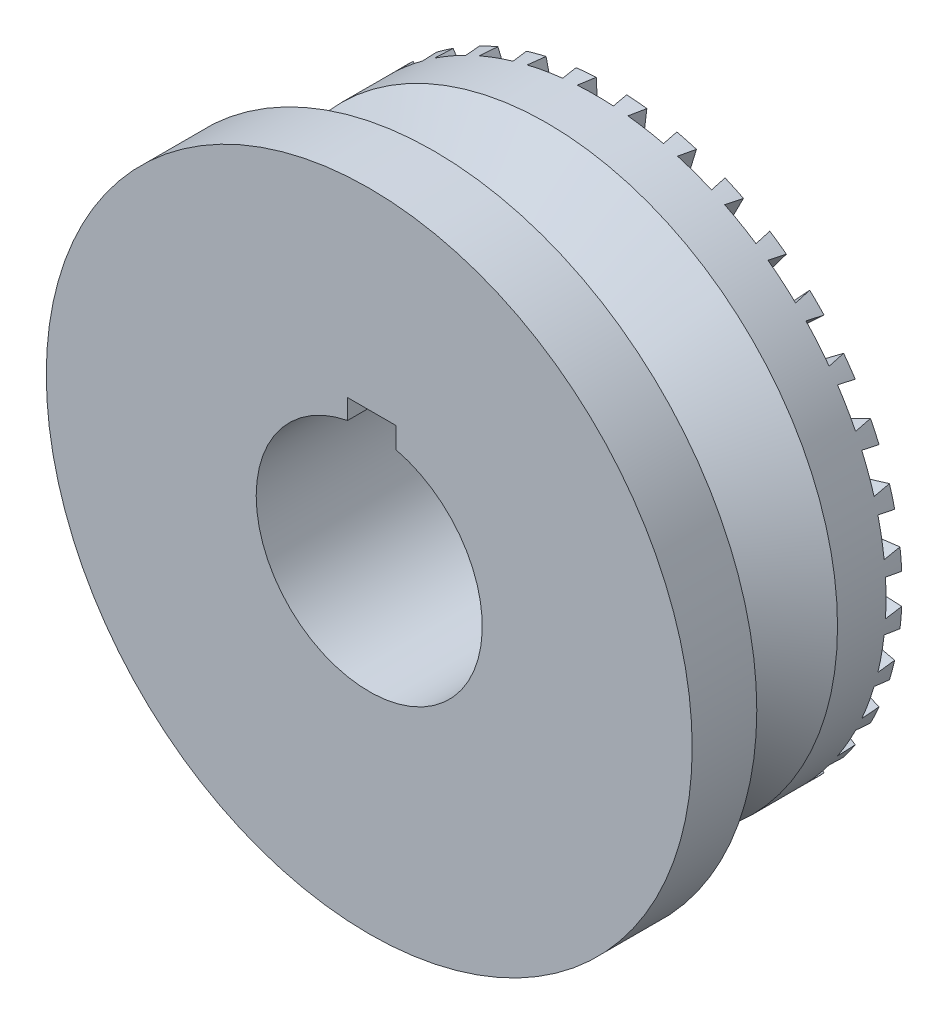
from build123d import *

# Parameters (mm, degrees)
SKETCH_2_R                       = 10
SKETCH_2_R_2                     = 7
CUT_EXTRUDE_1_DEPTH              = 4
CUT_EXTRUDE_2_REACH              = 34.016
SKETCH_2_3_R                     = 7
CUT_EXTRUDE_6_DEPTH              = 1
CUT_EXTRUDE_6_DRAFT              = 10
PATTERN_CIRCULAR_1_COPY_1_DEPTH  = 1
PATTERN_CIRCULAR_1_COPY_1_DRAFT  = 10
PATTERN_CIRCULAR_1_COPY_2_DEPTH  = 1
PATTERN_CIRCULAR_1_COPY_2_DRAFT  = 10
PATTERN_CIRCULAR_1_COPY_3_DEPTH  = 1
PATTERN_CIRCULAR_1_COPY_3_DRAFT  = 10
PATTERN_CIRCULAR_1_COPY_4_DEPTH  = 1
PATTERN_CIRCULAR_1_COPY_4_DRAFT  = 10
PATTERN_CIRCULAR_1_COPY_5_DEPTH  = 1
PATTERN_CIRCULAR_1_COPY_5_DRAFT  = 10
PATTERN_CIRCULAR_1_COPY_6_DEPTH  = 1
PATTERN_CIRCULAR_1_COPY_6_DRAFT  = 10
PATTERN_CIRCULAR_1_COPY_7_DEPTH  = 1
PATTERN_CIRCULAR_1_COPY_7_DRAFT  = 10
PATTERN_CIRCULAR_1_COPY_8_DEPTH  = 1
PATTERN_CIRCULAR_1_COPY_8_DRAFT  = 10
PATTERN_CIRCULAR_1_COPY_9_DEPTH  = 1
PATTERN_CIRCULAR_1_COPY_9_DRAFT  = 10
PATTERN_CIRCULAR_1_COPY_10_DEPTH = 1
PATTERN_CIRCULAR_1_COPY_10_DRAFT = 10
PATTERN_CIRCULAR_1_COPY_11_DEPTH = 1
PATTERN_CIRCULAR_1_COPY_11_DRAFT = 10
PATTERN_CIRCULAR_1_COPY_12_DEPTH = 1
PATTERN_CIRCULAR_1_COPY_12_DRAFT = 10
PATTERN_CIRCULAR_1_COPY_13_DEPTH = 1
PATTERN_CIRCULAR_1_COPY_13_DRAFT = 10
PATTERN_CIRCULAR_1_COPY_14_DEPTH = 1
PATTERN_CIRCULAR_1_COPY_14_DRAFT = 10
PATTERN_CIRCULAR_1_COPY_15_DEPTH = 1
PATTERN_CIRCULAR_1_COPY_15_DRAFT = 10
PATTERN_CIRCULAR_1_COPY_16_DEPTH = 1
PATTERN_CIRCULAR_1_COPY_16_DRAFT = 10
PATTERN_CIRCULAR_1_COPY_17_DEPTH = 1
PATTERN_CIRCULAR_1_COPY_17_DRAFT = 10
PATTERN_CIRCULAR_1_COPY_18_DEPTH = 1
PATTERN_CIRCULAR_1_COPY_18_DRAFT = 10
PATTERN_CIRCULAR_1_COPY_19_DEPTH = 1
PATTERN_CIRCULAR_1_COPY_19_DRAFT = 10
PATTERN_CIRCULAR_1_COPY_20_DEPTH = 1
PATTERN_CIRCULAR_1_COPY_20_DRAFT = 10
PATTERN_CIRCULAR_1_COPY_21_DEPTH = 1
PATTERN_CIRCULAR_1_COPY_21_DRAFT = 10
PATTERN_CIRCULAR_1_COPY_22_DEPTH = 1
PATTERN_CIRCULAR_1_COPY_22_DRAFT = 10
PATTERN_CIRCULAR_1_COPY_23_DEPTH = 1
PATTERN_CIRCULAR_1_COPY_23_DRAFT = 10
PATTERN_CIRCULAR_1_COPY_24_DEPTH = 1
PATTERN_CIRCULAR_1_COPY_24_DRAFT = 10
PATTERN_CIRCULAR_1_COPY_25_DEPTH = 1
PATTERN_CIRCULAR_1_COPY_25_DRAFT = 10
PATTERN_CIRCULAR_1_COPY_26_DEPTH = 1
PATTERN_CIRCULAR_1_COPY_26_DRAFT = 10
PATTERN_CIRCULAR_1_COPY_27_DEPTH = 1
PATTERN_CIRCULAR_1_COPY_27_DRAFT = 10
PATTERN_CIRCULAR_1_COPY_28_DEPTH = 1
PATTERN_CIRCULAR_1_COPY_28_DRAFT = 10
PATTERN_CIRCULAR_1_COPY_29_DEPTH = 1
PATTERN_CIRCULAR_1_COPY_29_DRAFT = 10
PATTERN_CIRCULAR_1_COPY_30_DEPTH = 1
PATTERN_CIRCULAR_1_COPY_30_DRAFT = 10
PATTERN_CIRCULAR_1_COPY_31_DEPTH = 1
PATTERN_CIRCULAR_1_COPY_31_DRAFT = 10
PATTERN_CIRCULAR_1_COPY_32_DEPTH = 1
PATTERN_CIRCULAR_1_COPY_32_DRAFT = 10
PATTERN_CIRCULAR_1_COPY_33_DEPTH = 1
PATTERN_CIRCULAR_1_COPY_33_DRAFT = 10
PATTERN_CIRCULAR_1_COPY_34_DEPTH = 1
PATTERN_CIRCULAR_1_COPY_34_DRAFT = 10
PATTERN_CIRCULAR_1_COPY_35_DEPTH = 1
PATTERN_CIRCULAR_1_COPY_35_DRAFT = 10
CUT_EXTRUDE_7_DEPTH              = 31.347981811


with BuildPart() as part:
    # 草图1 → 旋转1 (revolve)
    with BuildSketch(Plane(origin=(0, 0, 0), x_dir=(0, 0, -1), z_dir=(1, 0, 0))):
        Polygon((-7, 20), (-7, 0), (8, 0), (8, 18), (4, 18), (0, 13), (-3, 13), (-3, 20), align=None)
    revolve(axis=Axis((0, 0, 7), (0, 0, -1)))

    # 草图2 → 切除-拉伸1 (cut)
    with BuildSketch(Plane(origin=(0, 0, -8), x_dir=(-1, 0, 0), z_dir=(0, 0, -1))):
        Circle(SKETCH_2_R)
        Circle(SKETCH_2_R_2, mode=Mode.SUBTRACT)
    extrude(amount=-CUT_EXTRUDE_1_DEPTH, mode=Mode.SUBTRACT)

    # 草图2<3> → 切除-拉伸2 (cut, up to next)
    with BuildSketch(Plane(origin=(0, 0, -8), x_dir=(-1, 0, 0), z_dir=(0, 0, -1)), mode=Mode.PRIVATE) as cut_extrude_2_sk1:
        Circle(SKETCH_2_3_R)
    cut_extrude_2_tool1 = extrude(cut_extrude_2_sk1.sketch, amount=-CUT_EXTRUDE_2_REACH, mode=Mode.PRIVATE) & part.part
    add(cut_extrude_2_tool1.solids().sort_by_distance((0, 0, -8))[0], mode=Mode.SUBTRACT)


with BuildPart() as cut_extrude_6_tool:
    # 草图3 → 切除-拉伸6 (with draft: the straight prism first)
    with BuildSketch(Plane(origin=(0, 0, -8), x_dir=(-1, 0, 0), z_dir=(0, 0, -1))):
        with BuildLine():
            Line((-0.942047212, 17.975331626), (0, 0))
            Line((0, 0), (0.942047212, 17.975331626))
            ThreePointArc((0.942047212, 17.975331626), (0, 18), (-0.942047212, 17.975331626))
        make_face()
    extrude(amount=-CUT_EXTRUDE_6_DEPTH)
    # 切除-拉伸6: the draft: its side faces are tilted about the plane it starts from
    cut_extrude_6_sides = [cut_extrude_6_tool.faces().sort_by_distance(p)[0] for p in [
        (0.471023606, 8.987665813, -7.5),
        (-0.471023606, 8.987665813, -7.5),
        (0, 18, -7.5),
    ]]
    draft(cut_extrude_6_sides, Plane(origin=(0, 0, -8), x_dir=(-1, 0, 0), z_dir=(0, 0, -1)), CUT_EXTRUDE_6_DRAFT)


with BuildPart() as part_1:
    add(part.part)

    # 切除-拉伸6: cut by cut_extrude_6_tool
    add(cut_extrude_6_tool.part, mode=Mode.SUBTRACT)


with BuildPart() as pattern_circular_1_copy_1_tool:
    # 阵列(圆周)1 copy 1 sketch → 阵列(圆周)1 copy 1 (with draft: the straight prism first)
    with BuildSketch(Plane(origin=(0, 0, -8), x_dir=(-0.984807753012208, -0.17364817766693033, 0), z_dir=(0, 0, -1))):
        with BuildLine():
            Line((-0.942047212, 17.975331626), (0, 0))
            Line((0, 0), (0.942047212, 17.975331626))
            ThreePointArc((0.942047212, 17.975331626), (0, 18), (-0.942047212, 17.975331626))
        make_face()
    extrude(amount=-PATTERN_CIRCULAR_1_COPY_1_DEPTH)
    # 阵列(圆周)1 copy 1: the draft: its side faces are tilted about the plane it starts from
    pattern_circular_1_copy_1_sides = [pattern_circular_1_copy_1_tool.faces().sort_by_distance(p)[0] for p in [
        (-1.096824091, 8.932915365, -7.5),
        (-2.024559489, 8.769330583, -7.5),
        (-3.125667198, 17.726539554, -7.5),
    ]]
    draft(pattern_circular_1_copy_1_sides, Plane(origin=(0, 0, -8), x_dir=(-0.984807753012208, -0.17364817766693033, 0), z_dir=(0, 0, -1)), PATTERN_CIRCULAR_1_COPY_1_DRAFT)


with BuildPart() as part_2:
    add(part_1.part)

    # 阵列(圆周)1 copy 1: cut by pattern_circular_1_copy_1_tool
    add(pattern_circular_1_copy_1_tool.part, mode=Mode.SUBTRACT)


with BuildPart() as pattern_circular_1_copy_2_tool:
    # 阵列(圆周)1 copy 2 sketch → 阵列(圆周)1 copy 2 (with draft: the straight prism first)
    with BuildSketch(Plane(origin=(0, 0, -8), x_dir=(-0.9396926207859084, -0.3420201433256687, 0), z_dir=(0, 0, -1))):
        with BuildLine():
            Line((-0.942047212, 17.975331626), (0, 0))
            Line((0, 0), (0.942047212, 17.975331626))
            ThreePointArc((0.942047212, 17.975331626), (0, 18), (-0.942047212, 17.975331626))
        make_face()
    extrude(amount=-PATTERN_CIRCULAR_1_COPY_2_DEPTH)
    # 阵列(圆周)1 copy 2: the draft: its side faces are tilted about the plane it starts from
    pattern_circular_1_copy_2_sides = [pattern_circular_1_copy_2_tool.faces().sort_by_distance(p)[0] for p in [
        (-2.631345343, 8.606742804, -7.5),
        (-3.516580156, 8.284543681, -7.5),
        (-6.15636258, 16.914467174, -7.5),
    ]]
    draft(pattern_circular_1_copy_2_sides, Plane(origin=(0, 0, -8), x_dir=(-0.9396926207859084, -0.3420201433256687, 0), z_dir=(0, 0, -1)), PATTERN_CIRCULAR_1_COPY_2_DRAFT)


with BuildPart() as part_3:
    add(part_2.part)

    # 阵列(圆周)1 copy 2: cut by pattern_circular_1_copy_2_tool
    add(pattern_circular_1_copy_2_tool.part, mode=Mode.SUBTRACT)


with BuildPart() as pattern_circular_1_copy_3_tool:
    # 阵列(圆周)1 copy 3 sketch → 阵列(圆周)1 copy 3 (with draft: the straight prism first)
    with BuildSketch(Plane(origin=(0, 0, -8), x_dir=(-0.8660254037844387, -0.49999999999999994, 0), z_dir=(0, 0, -1))):
        with BuildLine():
            Line((-0.942047212, 17.975331626), (0, 0))
            Line((0, 0), (0.942047212, 17.975331626))
            ThreePointArc((0.942047212, 17.975331626), (0, 18), (-0.942047212, 17.975331626))
        make_face()
    extrude(amount=-PATTERN_CIRCULAR_1_COPY_3_DEPTH)
    # 阵列(圆周)1 copy 3: the draft: its side faces are tilted about the plane it starts from
    pattern_circular_1_copy_3_sides = [pattern_circular_1_copy_3_tool.faces().sort_by_distance(p)[0] for p in [
        (-4.085914498, 8.019058718, -7.5),
        (-4.901751315, 7.548035112, -7.5),
        (-9, 15.588457268, -7.5),
    ]]
    draft(pattern_circular_1_copy_3_sides, Plane(origin=(0, 0, -8), x_dir=(-0.8660254037844387, -0.49999999999999994, 0), z_dir=(0, 0, -1)), PATTERN_CIRCULAR_1_COPY_3_DRAFT)


with BuildPart() as part_4:
    add(part_3.part)

    # 阵列(圆周)1 copy 3: cut by pattern_circular_1_copy_3_tool
    add(pattern_circular_1_copy_3_tool.part, mode=Mode.SUBTRACT)


with BuildPart() as pattern_circular_1_copy_4_tool:
    # 阵列(圆周)1 copy 4 sketch → 阵列(圆周)1 copy 4 (with draft: the straight prism first)
    with BuildSketch(Plane(origin=(0, 0, -8), x_dir=(-0.766044443118978, -0.6427876096865393, 0), z_dir=(0, 0, -1))):
        with BuildLine():
            Line((-0.942047212, 17.975331626), (0, 0))
            Line((0, 0), (0.942047212, 17.975331626))
            ThreePointArc((0.942047212, 17.975331626), (0, 18), (-0.942047212, 17.975331626))
        make_face()
    extrude(amount=-PATTERN_CIRCULAR_1_COPY_4_DEPTH)
    # 阵列(圆周)1 copy 4: the draft: its side faces are tilted about the plane it starts from
    pattern_circular_1_copy_4_sides = [pattern_circular_1_copy_4_tool.faces().sort_by_distance(p)[0] for p in [
        (-5.416335209, 7.18771959, -7.5),
        (-6.137985241, 6.582183315, -7.5),
        (-11.570176974, 13.788799976, -7.5),
    ]]
    draft(pattern_circular_1_copy_4_sides, Plane(origin=(0, 0, -8), x_dir=(-0.766044443118978, -0.6427876096865393, 0), z_dir=(0, 0, -1)), PATTERN_CIRCULAR_1_COPY_4_DRAFT)


with BuildPart() as part_5:
    add(part_4.part)

    # 阵列(圆周)1 copy 4: cut by pattern_circular_1_copy_4_tool
    add(pattern_circular_1_copy_4_tool.part, mode=Mode.SUBTRACT)


with BuildPart() as pattern_circular_1_copy_5_tool:
    # 阵列(圆周)1 copy 5 sketch → 阵列(圆周)1 copy 5 (with draft: the straight prism first)
    with BuildSketch(Plane(origin=(0, 0, -8), x_dir=(-0.6427876096865394, -0.766044443118978, 0), z_dir=(0, 0, -1))):
        with BuildLine():
            Line((-0.942047212, 17.975331626), (0, 0))
            Line((0, 0), (0.942047212, 17.975331626))
            ThreePointArc((0.942047212, 17.975331626), (0, 18), (-0.942047212, 17.975331626))
        make_face()
    extrude(amount=-PATTERN_CIRCULAR_1_COPY_5_DEPTH)
    # 阵列(圆周)1 copy 5: the draft: its side faces are tilted about the plane it starts from
    pattern_circular_1_copy_5_sides = [pattern_circular_1_copy_5_tool.faces().sort_by_distance(p)[0] for p in [
        (-6.582183315, 6.137985241, -7.5),
        (-7.18771959, 5.416335209, -7.5),
        (-13.788799976, 11.570176974, -7.5),
    ]]
    draft(pattern_circular_1_copy_5_sides, Plane(origin=(0, 0, -8), x_dir=(-0.6427876096865394, -0.766044443118978, 0), z_dir=(0, 0, -1)), PATTERN_CIRCULAR_1_COPY_5_DRAFT)


with BuildPart() as part_6:
    add(part_5.part)

    # 阵列(圆周)1 copy 5: cut by pattern_circular_1_copy_5_tool
    add(pattern_circular_1_copy_5_tool.part, mode=Mode.SUBTRACT)


with BuildPart() as pattern_circular_1_copy_6_tool:
    # 阵列(圆周)1 copy 6 sketch → 阵列(圆周)1 copy 6 (with draft: the straight prism first)
    with BuildSketch(Plane(origin=(0, 0, -8), x_dir=(-0.5000000000000001, -0.8660254037844386, 0), z_dir=(0, 0, -1))):
        with BuildLine():
            Line((-0.942047212, 17.975331626), (0, 0))
            Line((0, 0), (0.942047212, 17.975331626))
            ThreePointArc((0.942047212, 17.975331626), (0, 18), (-0.942047212, 17.975331626))
        make_face()
    extrude(amount=-PATTERN_CIRCULAR_1_COPY_6_DEPTH)
    # 阵列(圆周)1 copy 6: the draft: its side faces are tilted about the plane it starts from
    pattern_circular_1_copy_6_sides = [pattern_circular_1_copy_6_tool.faces().sort_by_distance(p)[0] for p in [
        (-7.548035112, 4.901751315, -7.5),
        (-8.019058718, 4.085914498, -7.5),
        (-15.588457268, 9, -7.5),
    ]]
    draft(pattern_circular_1_copy_6_sides, Plane(origin=(0, 0, -8), x_dir=(-0.5000000000000001, -0.8660254037844386, 0), z_dir=(0, 0, -1)), PATTERN_CIRCULAR_1_COPY_6_DRAFT)


with BuildPart() as part_7:
    add(part_6.part)

    # 阵列(圆周)1 copy 6: cut by pattern_circular_1_copy_6_tool
    add(pattern_circular_1_copy_6_tool.part, mode=Mode.SUBTRACT)


with BuildPart() as pattern_circular_1_copy_7_tool:
    # 阵列(圆周)1 copy 7 sketch → 阵列(圆周)1 copy 7 (with draft: the straight prism first)
    with BuildSketch(Plane(origin=(0, 0, -8), x_dir=(-0.3420201433256688, -0.9396926207859083, 0), z_dir=(0, 0, -1))):
        with BuildLine():
            Line((-0.942047212, 17.975331626), (0, 0))
            Line((0, 0), (0.942047212, 17.975331626))
            ThreePointArc((0.942047212, 17.975331626), (0, 18), (-0.942047212, 17.975331626))
        make_face()
    extrude(amount=-PATTERN_CIRCULAR_1_COPY_7_DEPTH)
    # 阵列(圆周)1 copy 7: the draft: its side faces are tilted about the plane it starts from
    pattern_circular_1_copy_7_sides = [pattern_circular_1_copy_7_tool.faces().sort_by_distance(p)[0] for p in [
        (-8.284543681, 3.516580156, -7.5),
        (-8.606742804, 2.631345343, -7.5),
        (-16.914467174, 6.15636258, -7.5),
    ]]
    draft(pattern_circular_1_copy_7_sides, Plane(origin=(0, 0, -8), x_dir=(-0.3420201433256688, -0.9396926207859083, 0), z_dir=(0, 0, -1)), PATTERN_CIRCULAR_1_COPY_7_DRAFT)


with BuildPart() as part_8:
    add(part_7.part)

    # 阵列(圆周)1 copy 7: cut by pattern_circular_1_copy_7_tool
    add(pattern_circular_1_copy_7_tool.part, mode=Mode.SUBTRACT)


with BuildPart() as pattern_circular_1_copy_8_tool:
    # 阵列(圆周)1 copy 8 sketch → 阵列(圆周)1 copy 8 (with draft: the straight prism first)
    with BuildSketch(Plane(origin=(0, 0, -8), x_dir=(-0.17364817766693041, -0.984807753012208, 0), z_dir=(0, 0, -1))):
        with BuildLine():
            Line((-0.942047212, 17.975331626), (0, 0))
            Line((0, 0), (0.942047212, 17.975331626))
            ThreePointArc((0.942047212, 17.975331626), (0, 18), (-0.942047212, 17.975331626))
        make_face()
    extrude(amount=-PATTERN_CIRCULAR_1_COPY_8_DEPTH)
    # 阵列(圆周)1 copy 8: the draft: its side faces are tilted about the plane it starts from
    pattern_circular_1_copy_8_sides = [pattern_circular_1_copy_8_tool.faces().sort_by_distance(p)[0] for p in [
        (-8.769330583, 2.024559489, -7.5),
        (-8.932915365, 1.096824091, -7.5),
        (-17.726539554, 3.125667198, -7.5),
    ]]
    draft(pattern_circular_1_copy_8_sides, Plane(origin=(0, 0, -8), x_dir=(-0.17364817766693041, -0.984807753012208, 0), z_dir=(0, 0, -1)), PATTERN_CIRCULAR_1_COPY_8_DRAFT)


with BuildPart() as part_9:
    add(part_8.part)

    # 阵列(圆周)1 copy 8: cut by pattern_circular_1_copy_8_tool
    add(pattern_circular_1_copy_8_tool.part, mode=Mode.SUBTRACT)


with BuildPart() as pattern_circular_1_copy_9_tool:
    # 阵列(圆周)1 copy 9 sketch → 阵列(圆周)1 copy 9 (with draft: the straight prism first)
    with BuildSketch(Plane(origin=(0, 0, -8), x_dir=(0, -1, 0), z_dir=(0, 0, -1))):
        with BuildLine():
            Line((-0.942047212, 17.975331626), (0, 0))
            Line((0, 0), (0.942047212, 17.975331626))
            ThreePointArc((0.942047212, 17.975331626), (0, 18), (-0.942047212, 17.975331626))
        make_face()
    extrude(amount=-PATTERN_CIRCULAR_1_COPY_9_DEPTH)
    # 阵列(圆周)1 copy 9: the draft: its side faces are tilted about the plane it starts from
    pattern_circular_1_copy_9_sides = [pattern_circular_1_copy_9_tool.faces().sort_by_distance(p)[0] for p in [
        (-8.987665813, 0.471023606, -7.5),
        (-8.987665813, -0.471023606, -7.5),
        (-18, 0, -7.5),
    ]]
    draft(pattern_circular_1_copy_9_sides, Plane(origin=(0, 0, -8), x_dir=(0, -1, 0), z_dir=(0, 0, -1)), PATTERN_CIRCULAR_1_COPY_9_DRAFT)


with BuildPart() as part_10:
    add(part_9.part)

    # 阵列(圆周)1 copy 9: cut by pattern_circular_1_copy_9_tool
    add(pattern_circular_1_copy_9_tool.part, mode=Mode.SUBTRACT)


with BuildPart() as pattern_circular_1_copy_10_tool:
    # 阵列(圆周)1 copy 10 sketch → 阵列(圆周)1 copy 10 (with draft: the straight prism first)
    with BuildSketch(Plane(origin=(0, 0, -8), x_dir=(0.1736481776669303, -0.984807753012208, 0), z_dir=(0, 0, -1))):
        with BuildLine():
            Line((-0.942047212, 17.975331626), (0, 0))
            Line((0, 0), (0.942047212, 17.975331626))
            ThreePointArc((0.942047212, 17.975331626), (0, 18), (-0.942047212, 17.975331626))
        make_face()
    extrude(amount=-PATTERN_CIRCULAR_1_COPY_10_DEPTH)
    # 阵列(圆周)1 copy 10: the draft: its side faces are tilted about the plane it starts from
    pattern_circular_1_copy_10_sides = [pattern_circular_1_copy_10_tool.faces().sort_by_distance(p)[0] for p in [
        (-8.932915365, -1.096824091, -7.5),
        (-8.769330583, -2.024559489, -7.5),
        (-17.726539554, -3.125667198, -7.5),
    ]]
    draft(pattern_circular_1_copy_10_sides, Plane(origin=(0, 0, -8), x_dir=(0.1736481776669303, -0.984807753012208, 0), z_dir=(0, 0, -1)), PATTERN_CIRCULAR_1_COPY_10_DRAFT)


with BuildPart() as part_11:
    add(part_10.part)

    # 阵列(圆周)1 copy 10: cut by pattern_circular_1_copy_10_tool
    add(pattern_circular_1_copy_10_tool.part, mode=Mode.SUBTRACT)


with BuildPart() as pattern_circular_1_copy_11_tool:
    # 阵列(圆周)1 copy 11 sketch → 阵列(圆周)1 copy 11 (with draft: the straight prism first)
    with BuildSketch(Plane(origin=(0, 0, -8), x_dir=(0.3420201433256687, -0.9396926207859084, 0), z_dir=(0, 0, -1))):
        with BuildLine():
            Line((-0.942047212, 17.975331626), (0, 0))
            Line((0, 0), (0.942047212, 17.975331626))
            ThreePointArc((0.942047212, 17.975331626), (0, 18), (-0.942047212, 17.975331626))
        make_face()
    extrude(amount=-PATTERN_CIRCULAR_1_COPY_11_DEPTH)
    # 阵列(圆周)1 copy 11: the draft: its side faces are tilted about the plane it starts from
    pattern_circular_1_copy_11_sides = [pattern_circular_1_copy_11_tool.faces().sort_by_distance(p)[0] for p in [
        (-8.606742804, -2.631345343, -7.5),
        (-8.284543681, -3.516580156, -7.5),
        (-16.914467174, -6.15636258, -7.5),
    ]]
    draft(pattern_circular_1_copy_11_sides, Plane(origin=(0, 0, -8), x_dir=(0.3420201433256687, -0.9396926207859084, 0), z_dir=(0, 0, -1)), PATTERN_CIRCULAR_1_COPY_11_DRAFT)


with BuildPart() as part_12:
    add(part_11.part)

    # 阵列(圆周)1 copy 11: cut by pattern_circular_1_copy_11_tool
    add(pattern_circular_1_copy_11_tool.part, mode=Mode.SUBTRACT)


with BuildPart() as pattern_circular_1_copy_12_tool:
    # 阵列(圆周)1 copy 12 sketch → 阵列(圆周)1 copy 12 (with draft: the straight prism first)
    with BuildSketch(Plane(origin=(0, 0, -8), x_dir=(0.4999999999999998, -0.8660254037844387, 0), z_dir=(0, 0, -1))):
        with BuildLine():
            Line((-0.942047212, 17.975331626), (0, 0))
            Line((0, 0), (0.942047212, 17.975331626))
            ThreePointArc((0.942047212, 17.975331626), (0, 18), (-0.942047212, 17.975331626))
        make_face()
    extrude(amount=-PATTERN_CIRCULAR_1_COPY_12_DEPTH)
    # 阵列(圆周)1 copy 12: the draft: its side faces are tilted about the plane it starts from
    pattern_circular_1_copy_12_sides = [pattern_circular_1_copy_12_tool.faces().sort_by_distance(p)[0] for p in [
        (-8.019058718, -4.085914498, -7.5),
        (-7.548035112, -4.901751315, -7.5),
        (-15.588457268, -9, -7.5),
    ]]
    draft(pattern_circular_1_copy_12_sides, Plane(origin=(0, 0, -8), x_dir=(0.4999999999999998, -0.8660254037844387, 0), z_dir=(0, 0, -1)), PATTERN_CIRCULAR_1_COPY_12_DRAFT)


with BuildPart() as part_13:
    add(part_12.part)

    # 阵列(圆周)1 copy 12: cut by pattern_circular_1_copy_12_tool
    add(pattern_circular_1_copy_12_tool.part, mode=Mode.SUBTRACT)


with BuildPart() as pattern_circular_1_copy_13_tool:
    # 阵列(圆周)1 copy 13 sketch → 阵列(圆周)1 copy 13 (with draft: the straight prism first)
    with BuildSketch(Plane(origin=(0, 0, -8), x_dir=(0.6427876096865394, -0.766044443118978, 0), z_dir=(0, 0, -1))):
        with BuildLine():
            Line((-0.942047212, 17.975331626), (0, 0))
            Line((0, 0), (0.942047212, 17.975331626))
            ThreePointArc((0.942047212, 17.975331626), (0, 18), (-0.942047212, 17.975331626))
        make_face()
    extrude(amount=-PATTERN_CIRCULAR_1_COPY_13_DEPTH)
    # 阵列(圆周)1 copy 13: the draft: its side faces are tilted about the plane it starts from
    pattern_circular_1_copy_13_sides = [pattern_circular_1_copy_13_tool.faces().sort_by_distance(p)[0] for p in [
        (-7.18771959, -5.416335209, -7.5),
        (-6.582183315, -6.137985241, -7.5),
        (-13.788799976, -11.570176974, -7.5),
    ]]
    draft(pattern_circular_1_copy_13_sides, Plane(origin=(0, 0, -8), x_dir=(0.6427876096865394, -0.766044443118978, 0), z_dir=(0, 0, -1)), PATTERN_CIRCULAR_1_COPY_13_DRAFT)


with BuildPart() as part_14:
    add(part_13.part)

    # 阵列(圆周)1 copy 13: cut by pattern_circular_1_copy_13_tool
    add(pattern_circular_1_copy_13_tool.part, mode=Mode.SUBTRACT)


with BuildPart() as pattern_circular_1_copy_14_tool:
    # 阵列(圆周)1 copy 14 sketch → 阵列(圆周)1 copy 14 (with draft: the straight prism first)
    with BuildSketch(Plane(origin=(0, 0, -8), x_dir=(0.7660444431189779, -0.6427876096865395, 0), z_dir=(0, 0, -1))):
        with BuildLine():
            Line((-0.942047212, 17.975331626), (0, 0))
            Line((0, 0), (0.942047212, 17.975331626))
            ThreePointArc((0.942047212, 17.975331626), (0, 18), (-0.942047212, 17.975331626))
        make_face()
    extrude(amount=-PATTERN_CIRCULAR_1_COPY_14_DEPTH)
    # 阵列(圆周)1 copy 14: the draft: its side faces are tilted about the plane it starts from
    pattern_circular_1_copy_14_sides = [pattern_circular_1_copy_14_tool.faces().sort_by_distance(p)[0] for p in [
        (-6.137985241, -6.582183315, -7.5),
        (-5.416335209, -7.18771959, -7.5),
        (-11.570176974, -13.788799976, -7.5),
    ]]
    draft(pattern_circular_1_copy_14_sides, Plane(origin=(0, 0, -8), x_dir=(0.7660444431189779, -0.6427876096865395, 0), z_dir=(0, 0, -1)), PATTERN_CIRCULAR_1_COPY_14_DRAFT)


with BuildPart() as part_15:
    add(part_14.part)

    # 阵列(圆周)1 copy 14: cut by pattern_circular_1_copy_14_tool
    add(pattern_circular_1_copy_14_tool.part, mode=Mode.SUBTRACT)


with BuildPart() as pattern_circular_1_copy_15_tool:
    # 阵列(圆周)1 copy 15 sketch → 阵列(圆周)1 copy 15 (with draft: the straight prism first)
    with BuildSketch(Plane(origin=(0, 0, -8), x_dir=(0.8660254037844387, -0.49999999999999994, 0), z_dir=(0, 0, -1))):
        with BuildLine():
            Line((-0.942047212, 17.975331626), (0, 0))
            Line((0, 0), (0.942047212, 17.975331626))
            ThreePointArc((0.942047212, 17.975331626), (0, 18), (-0.942047212, 17.975331626))
        make_face()
    extrude(amount=-PATTERN_CIRCULAR_1_COPY_15_DEPTH)
    # 阵列(圆周)1 copy 15: the draft: its side faces are tilted about the plane it starts from
    pattern_circular_1_copy_15_sides = [pattern_circular_1_copy_15_tool.faces().sort_by_distance(p)[0] for p in [
        (-4.901751315, -7.548035112, -7.5),
        (-4.085914498, -8.019058718, -7.5),
        (-9, -15.588457268, -7.5),
    ]]
    draft(pattern_circular_1_copy_15_sides, Plane(origin=(0, 0, -8), x_dir=(0.8660254037844387, -0.49999999999999994, 0), z_dir=(0, 0, -1)), PATTERN_CIRCULAR_1_COPY_15_DRAFT)


with BuildPart() as part_16:
    add(part_15.part)

    # 阵列(圆周)1 copy 15: cut by pattern_circular_1_copy_15_tool
    add(pattern_circular_1_copy_15_tool.part, mode=Mode.SUBTRACT)


with BuildPart() as pattern_circular_1_copy_16_tool:
    # 阵列(圆周)1 copy 16 sketch → 阵列(圆周)1 copy 16 (with draft: the straight prism first)
    with BuildSketch(Plane(origin=(0, 0, -8), x_dir=(0.9396926207859083, -0.3420201433256689, 0), z_dir=(0, 0, -1))):
        with BuildLine():
            Line((-0.942047212, 17.975331626), (0, 0))
            Line((0, 0), (0.942047212, 17.975331626))
            ThreePointArc((0.942047212, 17.975331626), (0, 18), (-0.942047212, 17.975331626))
        make_face()
    extrude(amount=-PATTERN_CIRCULAR_1_COPY_16_DEPTH)
    # 阵列(圆周)1 copy 16: the draft: its side faces are tilted about the plane it starts from
    pattern_circular_1_copy_16_sides = [pattern_circular_1_copy_16_tool.faces().sort_by_distance(p)[0] for p in [
        (-3.516580156, -8.284543681, -7.5),
        (-2.631345343, -8.606742804, -7.5),
        (-6.15636258, -16.914467174, -7.5),
    ]]
    draft(pattern_circular_1_copy_16_sides, Plane(origin=(0, 0, -8), x_dir=(0.9396926207859083, -0.3420201433256689, 0), z_dir=(0, 0, -1)), PATTERN_CIRCULAR_1_COPY_16_DRAFT)


with BuildPart() as part_17:
    add(part_16.part)

    # 阵列(圆周)1 copy 16: cut by pattern_circular_1_copy_16_tool
    add(pattern_circular_1_copy_16_tool.part, mode=Mode.SUBTRACT)


with BuildPart() as pattern_circular_1_copy_17_tool:
    # 阵列(圆周)1 copy 17 sketch → 阵列(圆周)1 copy 17 (with draft: the straight prism first)
    with BuildSketch(Plane(origin=(0, 0, -8), x_dir=(0.984807753012208, -0.17364817766693028, 0), z_dir=(0, 0, -1))):
        with BuildLine():
            Line((-0.942047212, 17.975331626), (0, 0))
            Line((0, 0), (0.942047212, 17.975331626))
            ThreePointArc((0.942047212, 17.975331626), (0, 18), (-0.942047212, 17.975331626))
        make_face()
    extrude(amount=-PATTERN_CIRCULAR_1_COPY_17_DEPTH)
    # 阵列(圆周)1 copy 17: the draft: its side faces are tilted about the plane it starts from
    pattern_circular_1_copy_17_sides = [pattern_circular_1_copy_17_tool.faces().sort_by_distance(p)[0] for p in [
        (-2.024559489, -8.769330583, -7.5),
        (-1.096824091, -8.932915365, -7.5),
        (-3.125667198, -17.726539554, -7.5),
    ]]
    draft(pattern_circular_1_copy_17_sides, Plane(origin=(0, 0, -8), x_dir=(0.984807753012208, -0.17364817766693028, 0), z_dir=(0, 0, -1)), PATTERN_CIRCULAR_1_COPY_17_DRAFT)


with BuildPart() as part_18:
    add(part_17.part)

    # 阵列(圆周)1 copy 17: cut by pattern_circular_1_copy_17_tool
    add(pattern_circular_1_copy_17_tool.part, mode=Mode.SUBTRACT)


with BuildPart() as pattern_circular_1_copy_18_tool:
    # 阵列(圆周)1 copy 18 sketch → 阵列(圆周)1 copy 18 (with draft: the straight prism first)
    with BuildSketch(Plane(origin=(0, 0, -8), x_dir=(1, 0, 0), z_dir=(0, 0, -1))):
        with BuildLine():
            Line((-0.942047212, 17.975331626), (0, 0))
            Line((0, 0), (0.942047212, 17.975331626))
            ThreePointArc((0.942047212, 17.975331626), (0, 18), (-0.942047212, 17.975331626))
        make_face()
    extrude(amount=-PATTERN_CIRCULAR_1_COPY_18_DEPTH)
    # 阵列(圆周)1 copy 18: the draft: its side faces are tilted about the plane it starts from
    pattern_circular_1_copy_18_sides = [pattern_circular_1_copy_18_tool.faces().sort_by_distance(p)[0] for p in [
        (-0.471023606, -8.987665813, -7.5),
        (0.471023606, -8.987665813, -7.5),
        (0, -18, -7.5),
    ]]
    draft(pattern_circular_1_copy_18_sides, Plane(origin=(0, 0, -8), x_dir=(1, 0, 0), z_dir=(0, 0, -1)), PATTERN_CIRCULAR_1_COPY_18_DRAFT)


with BuildPart() as part_19:
    add(part_18.part)

    # 阵列(圆周)1 copy 18: cut by pattern_circular_1_copy_18_tool
    add(pattern_circular_1_copy_18_tool.part, mode=Mode.SUBTRACT)


with BuildPart() as pattern_circular_1_copy_19_tool:
    # 阵列(圆周)1 copy 19 sketch → 阵列(圆周)1 copy 19 (with draft: the straight prism first)
    with BuildSketch(Plane(origin=(0, 0, -8), x_dir=(0.984807753012208, 0.17364817766693047, 0), z_dir=(0, 0, -1))):
        with BuildLine():
            Line((-0.942047212, 17.975331626), (0, 0))
            Line((0, 0), (0.942047212, 17.975331626))
            ThreePointArc((0.942047212, 17.975331626), (0, 18), (-0.942047212, 17.975331626))
        make_face()
    extrude(amount=-PATTERN_CIRCULAR_1_COPY_19_DEPTH)
    # 阵列(圆周)1 copy 19: the draft: its side faces are tilted about the plane it starts from
    pattern_circular_1_copy_19_sides = [pattern_circular_1_copy_19_tool.faces().sort_by_distance(p)[0] for p in [
        (1.096824091, -8.932915365, -7.5),
        (2.024559489, -8.769330583, -7.5),
        (3.125667198, -17.726539554, -7.5),
    ]]
    draft(pattern_circular_1_copy_19_sides, Plane(origin=(0, 0, -8), x_dir=(0.984807753012208, 0.17364817766693047, 0), z_dir=(0, 0, -1)), PATTERN_CIRCULAR_1_COPY_19_DRAFT)


with BuildPart() as part_20:
    add(part_19.part)

    # 阵列(圆周)1 copy 19: cut by pattern_circular_1_copy_19_tool
    add(pattern_circular_1_copy_19_tool.part, mode=Mode.SUBTRACT)


with BuildPart() as pattern_circular_1_copy_20_tool:
    # 阵列(圆周)1 copy 20 sketch → 阵列(圆周)1 copy 20 (with draft: the straight prism first)
    with BuildSketch(Plane(origin=(0, 0, -8), x_dir=(0.9396926207859084, 0.34202014332566866, 0), z_dir=(0, 0, -1))):
        with BuildLine():
            Line((-0.942047212, 17.975331626), (0, 0))
            Line((0, 0), (0.942047212, 17.975331626))
            ThreePointArc((0.942047212, 17.975331626), (0, 18), (-0.942047212, 17.975331626))
        make_face()
    extrude(amount=-PATTERN_CIRCULAR_1_COPY_20_DEPTH)
    # 阵列(圆周)1 copy 20: the draft: its side faces are tilted about the plane it starts from
    pattern_circular_1_copy_20_sides = [pattern_circular_1_copy_20_tool.faces().sort_by_distance(p)[0] for p in [
        (2.631345343, -8.606742804, -7.5),
        (3.516580156, -8.284543681, -7.5),
        (6.15636258, -16.914467174, -7.5),
    ]]
    draft(pattern_circular_1_copy_20_sides, Plane(origin=(0, 0, -8), x_dir=(0.9396926207859084, 0.34202014332566866, 0), z_dir=(0, 0, -1)), PATTERN_CIRCULAR_1_COPY_20_DRAFT)


with BuildPart() as part_21:
    add(part_20.part)

    # 阵列(圆周)1 copy 20: cut by pattern_circular_1_copy_20_tool
    add(pattern_circular_1_copy_20_tool.part, mode=Mode.SUBTRACT)


with BuildPart() as pattern_circular_1_copy_21_tool:
    # 阵列(圆周)1 copy 21 sketch → 阵列(圆周)1 copy 21 (with draft: the straight prism first)
    with BuildSketch(Plane(origin=(0, 0, -8), x_dir=(0.8660254037844386, 0.5000000000000001, 0), z_dir=(0, 0, -1))):
        with BuildLine():
            Line((-0.942047212, 17.975331626), (0, 0))
            Line((0, 0), (0.942047212, 17.975331626))
            ThreePointArc((0.942047212, 17.975331626), (0, 18), (-0.942047212, 17.975331626))
        make_face()
    extrude(amount=-PATTERN_CIRCULAR_1_COPY_21_DEPTH)
    # 阵列(圆周)1 copy 21: the draft: its side faces are tilted about the plane it starts from
    pattern_circular_1_copy_21_sides = [pattern_circular_1_copy_21_tool.faces().sort_by_distance(p)[0] for p in [
        (4.085914498, -8.019058718, -7.5),
        (4.901751315, -7.548035112, -7.5),
        (9, -15.588457268, -7.5),
    ]]
    draft(pattern_circular_1_copy_21_sides, Plane(origin=(0, 0, -8), x_dir=(0.8660254037844386, 0.5000000000000001, 0), z_dir=(0, 0, -1)), PATTERN_CIRCULAR_1_COPY_21_DRAFT)


with BuildPart() as part_22:
    add(part_21.part)

    # 阵列(圆周)1 copy 21: cut by pattern_circular_1_copy_21_tool
    add(pattern_circular_1_copy_21_tool.part, mode=Mode.SUBTRACT)


with BuildPart() as pattern_circular_1_copy_22_tool:
    # 阵列(圆周)1 copy 22 sketch → 阵列(圆周)1 copy 22 (with draft: the straight prism first)
    with BuildSketch(Plane(origin=(0, 0, -8), x_dir=(0.766044443118978, 0.6427876096865393, 0), z_dir=(0, 0, -1))):
        with BuildLine():
            Line((-0.942047212, 17.975331626), (0, 0))
            Line((0, 0), (0.942047212, 17.975331626))
            ThreePointArc((0.942047212, 17.975331626), (0, 18), (-0.942047212, 17.975331626))
        make_face()
    extrude(amount=-PATTERN_CIRCULAR_1_COPY_22_DEPTH)
    # 阵列(圆周)1 copy 22: the draft: its side faces are tilted about the plane it starts from
    pattern_circular_1_copy_22_sides = [pattern_circular_1_copy_22_tool.faces().sort_by_distance(p)[0] for p in [
        (5.416335209, -7.18771959, -7.5),
        (6.137985241, -6.582183315, -7.5),
        (11.570176974, -13.788799976, -7.5),
    ]]
    draft(pattern_circular_1_copy_22_sides, Plane(origin=(0, 0, -8), x_dir=(0.766044443118978, 0.6427876096865393, 0), z_dir=(0, 0, -1)), PATTERN_CIRCULAR_1_COPY_22_DRAFT)


with BuildPart() as part_23:
    add(part_22.part)

    # 阵列(圆周)1 copy 22: cut by pattern_circular_1_copy_22_tool
    add(pattern_circular_1_copy_22_tool.part, mode=Mode.SUBTRACT)


with BuildPart() as pattern_circular_1_copy_23_tool:
    # 阵列(圆周)1 copy 23 sketch → 阵列(圆周)1 copy 23 (with draft: the straight prism first)
    with BuildSketch(Plane(origin=(0, 0, -8), x_dir=(0.6427876096865395, 0.7660444431189779, 0), z_dir=(0, 0, -1))):
        with BuildLine():
            Line((-0.942047212, 17.975331626), (0, 0))
            Line((0, 0), (0.942047212, 17.975331626))
            ThreePointArc((0.942047212, 17.975331626), (0, 18), (-0.942047212, 17.975331626))
        make_face()
    extrude(amount=-PATTERN_CIRCULAR_1_COPY_23_DEPTH)
    # 阵列(圆周)1 copy 23: the draft: its side faces are tilted about the plane it starts from
    pattern_circular_1_copy_23_sides = [pattern_circular_1_copy_23_tool.faces().sort_by_distance(p)[0] for p in [
        (6.582183315, -6.137985241, -7.5),
        (7.18771959, -5.416335209, -7.5),
        (13.788799976, -11.570176974, -7.5),
    ]]
    draft(pattern_circular_1_copy_23_sides, Plane(origin=(0, 0, -8), x_dir=(0.6427876096865395, 0.7660444431189779, 0), z_dir=(0, 0, -1)), PATTERN_CIRCULAR_1_COPY_23_DRAFT)


with BuildPart() as part_24:
    add(part_23.part)

    # 阵列(圆周)1 copy 23: cut by pattern_circular_1_copy_23_tool
    add(pattern_circular_1_copy_23_tool.part, mode=Mode.SUBTRACT)


with BuildPart() as pattern_circular_1_copy_24_tool:
    # 阵列(圆周)1 copy 24 sketch → 阵列(圆周)1 copy 24 (with draft: the straight prism first)
    with BuildSketch(Plane(origin=(0, 0, -8), x_dir=(0.5000000000000004, 0.8660254037844384, 0), z_dir=(0, 0, -1))):
        with BuildLine():
            Line((-0.942047212, 17.975331626), (0, 0))
            Line((0, 0), (0.942047212, 17.975331626))
            ThreePointArc((0.942047212, 17.975331626), (0, 18), (-0.942047212, 17.975331626))
        make_face()
    extrude(amount=-PATTERN_CIRCULAR_1_COPY_24_DEPTH)
    # 阵列(圆周)1 copy 24: the draft: its side faces are tilted about the plane it starts from
    pattern_circular_1_copy_24_sides = [pattern_circular_1_copy_24_tool.faces().sort_by_distance(p)[0] for p in [
        (7.548035112, -4.901751315, -7.5),
        (8.019058718, -4.085914498, -7.5),
        (15.588457268, -9, -7.5),
    ]]
    draft(pattern_circular_1_copy_24_sides, Plane(origin=(0, 0, -8), x_dir=(0.5000000000000004, 0.8660254037844384, 0), z_dir=(0, 0, -1)), PATTERN_CIRCULAR_1_COPY_24_DRAFT)


with BuildPart() as part_25:
    add(part_24.part)

    # 阵列(圆周)1 copy 24: cut by pattern_circular_1_copy_24_tool
    add(pattern_circular_1_copy_24_tool.part, mode=Mode.SUBTRACT)


with BuildPart() as pattern_circular_1_copy_25_tool:
    # 阵列(圆周)1 copy 25 sketch → 阵列(圆周)1 copy 25 (with draft: the straight prism first)
    with BuildSketch(Plane(origin=(0, 0, -8), x_dir=(0.34202014332566855, 0.9396926207859084, 0), z_dir=(0, 0, -1))):
        with BuildLine():
            Line((-0.942047212, 17.975331626), (0, 0))
            Line((0, 0), (0.942047212, 17.975331626))
            ThreePointArc((0.942047212, 17.975331626), (0, 18), (-0.942047212, 17.975331626))
        make_face()
    extrude(amount=-PATTERN_CIRCULAR_1_COPY_25_DEPTH)
    # 阵列(圆周)1 copy 25: the draft: its side faces are tilted about the plane it starts from
    pattern_circular_1_copy_25_sides = [pattern_circular_1_copy_25_tool.faces().sort_by_distance(p)[0] for p in [
        (8.284543681, -3.516580156, -7.5),
        (8.606742804, -2.631345343, -7.5),
        (16.914467174, -6.15636258, -7.5),
    ]]
    draft(pattern_circular_1_copy_25_sides, Plane(origin=(0, 0, -8), x_dir=(0.34202014332566855, 0.9396926207859084, 0), z_dir=(0, 0, -1)), PATTERN_CIRCULAR_1_COPY_25_DRAFT)


with BuildPart() as part_26:
    add(part_25.part)

    # 阵列(圆周)1 copy 25: cut by pattern_circular_1_copy_25_tool
    add(pattern_circular_1_copy_25_tool.part, mode=Mode.SUBTRACT)


with BuildPart() as pattern_circular_1_copy_26_tool:
    # 阵列(圆周)1 copy 26 sketch → 阵列(圆周)1 copy 26 (with draft: the straight prism first)
    with BuildSketch(Plane(origin=(0, 0, -8), x_dir=(0.17364817766693033, 0.984807753012208, 0), z_dir=(0, 0, -1))):
        with BuildLine():
            Line((-0.942047212, 17.975331626), (0, 0))
            Line((0, 0), (0.942047212, 17.975331626))
            ThreePointArc((0.942047212, 17.975331626), (0, 18), (-0.942047212, 17.975331626))
        make_face()
    extrude(amount=-PATTERN_CIRCULAR_1_COPY_26_DEPTH)
    # 阵列(圆周)1 copy 26: the draft: its side faces are tilted about the plane it starts from
    pattern_circular_1_copy_26_sides = [pattern_circular_1_copy_26_tool.faces().sort_by_distance(p)[0] for p in [
        (8.769330583, -2.024559489, -7.5),
        (8.932915365, -1.096824091, -7.5),
        (17.726539554, -3.125667198, -7.5),
    ]]
    draft(pattern_circular_1_copy_26_sides, Plane(origin=(0, 0, -8), x_dir=(0.17364817766693033, 0.984807753012208, 0), z_dir=(0, 0, -1)), PATTERN_CIRCULAR_1_COPY_26_DRAFT)


with BuildPart() as part_27:
    add(part_26.part)

    # 阵列(圆周)1 copy 26: cut by pattern_circular_1_copy_26_tool
    add(pattern_circular_1_copy_26_tool.part, mode=Mode.SUBTRACT)


with BuildPart() as pattern_circular_1_copy_27_tool:
    # 阵列(圆周)1 copy 27 sketch → 阵列(圆周)1 copy 27 (with draft: the straight prism first)
    with BuildSketch(Plane.YX.offset(8)):
        with BuildLine():
            Line((-0.942047212, 17.975331626), (0, 0))
            Line((0, 0), (0.942047212, 17.975331626))
            ThreePointArc((0.942047212, 17.975331626), (0, 18), (-0.942047212, 17.975331626))
        make_face()
    extrude(amount=-PATTERN_CIRCULAR_1_COPY_27_DEPTH)
    # 阵列(圆周)1 copy 27: the draft: its side faces are tilted about the plane it starts from
    pattern_circular_1_copy_27_sides = [pattern_circular_1_copy_27_tool.faces().sort_by_distance(p)[0] for p in [
        (8.987665813, -0.471023606, -7.5),
        (8.987665813, 0.471023606, -7.5),
        (18, 0, -7.5),
    ]]
    draft(pattern_circular_1_copy_27_sides, Plane.YX.offset(8), PATTERN_CIRCULAR_1_COPY_27_DRAFT)


with BuildPart() as part_28:
    add(part_27.part)

    # 阵列(圆周)1 copy 27: cut by pattern_circular_1_copy_27_tool
    add(pattern_circular_1_copy_27_tool.part, mode=Mode.SUBTRACT)


with BuildPart() as pattern_circular_1_copy_28_tool:
    # 阵列(圆周)1 copy 28 sketch → 阵列(圆周)1 copy 28 (with draft: the straight prism first)
    with BuildSketch(Plane(origin=(0, 0, -8), x_dir=(-0.17364817766692997, 0.9848077530122081, 0), z_dir=(0, 0, -1))):
        with BuildLine():
            Line((-0.942047212, 17.975331626), (0, 0))
            Line((0, 0), (0.942047212, 17.975331626))
            ThreePointArc((0.942047212, 17.975331626), (0, 18), (-0.942047212, 17.975331626))
        make_face()
    extrude(amount=-PATTERN_CIRCULAR_1_COPY_28_DEPTH)
    # 阵列(圆周)1 copy 28: the draft: its side faces are tilted about the plane it starts from
    pattern_circular_1_copy_28_sides = [pattern_circular_1_copy_28_tool.faces().sort_by_distance(p)[0] for p in [
        (8.932915365, 1.096824091, -7.5),
        (8.769330583, 2.024559489, -7.5),
        (17.726539554, 3.125667198, -7.5),
    ]]
    draft(pattern_circular_1_copy_28_sides, Plane(origin=(0, 0, -8), x_dir=(-0.17364817766692997, 0.9848077530122081, 0), z_dir=(0, 0, -1)), PATTERN_CIRCULAR_1_COPY_28_DRAFT)


with BuildPart() as part_29:
    add(part_28.part)

    # 阵列(圆周)1 copy 28: cut by pattern_circular_1_copy_28_tool
    add(pattern_circular_1_copy_28_tool.part, mode=Mode.SUBTRACT)


with BuildPart() as pattern_circular_1_copy_29_tool:
    # 阵列(圆周)1 copy 29 sketch → 阵列(圆周)1 copy 29 (with draft: the straight prism first)
    with BuildSketch(Plane(origin=(0, 0, -8), x_dir=(-0.342020143325669, 0.9396926207859083, 0), z_dir=(0, 0, -1))):
        with BuildLine():
            Line((-0.942047212, 17.975331626), (0, 0))
            Line((0, 0), (0.942047212, 17.975331626))
            ThreePointArc((0.942047212, 17.975331626), (0, 18), (-0.942047212, 17.975331626))
        make_face()
    extrude(amount=-PATTERN_CIRCULAR_1_COPY_29_DEPTH)
    # 阵列(圆周)1 copy 29: the draft: its side faces are tilted about the plane it starts from
    pattern_circular_1_copy_29_sides = [pattern_circular_1_copy_29_tool.faces().sort_by_distance(p)[0] for p in [
        (8.606742804, 2.631345343, -7.5),
        (8.284543681, 3.516580156, -7.5),
        (16.914467174, 6.15636258, -7.5),
    ]]
    draft(pattern_circular_1_copy_29_sides, Plane(origin=(0, 0, -8), x_dir=(-0.342020143325669, 0.9396926207859083, 0), z_dir=(0, 0, -1)), PATTERN_CIRCULAR_1_COPY_29_DRAFT)


with BuildPart() as part_30:
    add(part_29.part)

    # 阵列(圆周)1 copy 29: cut by pattern_circular_1_copy_29_tool
    add(pattern_circular_1_copy_29_tool.part, mode=Mode.SUBTRACT)


with BuildPart() as pattern_circular_1_copy_30_tool:
    # 阵列(圆周)1 copy 30 sketch → 阵列(圆周)1 copy 30 (with draft: the straight prism first)
    with BuildSketch(Plane(origin=(0, 0, -8), x_dir=(-0.5000000000000001, 0.8660254037844386, 0), z_dir=(0, 0, -1))):
        with BuildLine():
            Line((-0.942047212, 17.975331626), (0, 0))
            Line((0, 0), (0.942047212, 17.975331626))
            ThreePointArc((0.942047212, 17.975331626), (0, 18), (-0.942047212, 17.975331626))
        make_face()
    extrude(amount=-PATTERN_CIRCULAR_1_COPY_30_DEPTH)
    # 阵列(圆周)1 copy 30: the draft: its side faces are tilted about the plane it starts from
    pattern_circular_1_copy_30_sides = [pattern_circular_1_copy_30_tool.faces().sort_by_distance(p)[0] for p in [
        (8.019058718, 4.085914498, -7.5),
        (7.548035112, 4.901751315, -7.5),
        (15.588457268, 9, -7.5),
    ]]
    draft(pattern_circular_1_copy_30_sides, Plane(origin=(0, 0, -8), x_dir=(-0.5000000000000001, 0.8660254037844386, 0), z_dir=(0, 0, -1)), PATTERN_CIRCULAR_1_COPY_30_DRAFT)


with BuildPart() as part_31:
    add(part_30.part)

    # 阵列(圆周)1 copy 30: cut by pattern_circular_1_copy_30_tool
    add(pattern_circular_1_copy_30_tool.part, mode=Mode.SUBTRACT)


with BuildPart() as pattern_circular_1_copy_31_tool:
    # 阵列(圆周)1 copy 31 sketch → 阵列(圆周)1 copy 31 (with draft: the straight prism first)
    with BuildSketch(Plane(origin=(0, 0, -8), x_dir=(-0.6427876096865393, 0.7660444431189781, 0), z_dir=(0, 0, -1))):
        with BuildLine():
            Line((-0.942047212, 17.975331626), (0, 0))
            Line((0, 0), (0.942047212, 17.975331626))
            ThreePointArc((0.942047212, 17.975331626), (0, 18), (-0.942047212, 17.975331626))
        make_face()
    extrude(amount=-PATTERN_CIRCULAR_1_COPY_31_DEPTH)
    # 阵列(圆周)1 copy 31: the draft: its side faces are tilted about the plane it starts from
    pattern_circular_1_copy_31_sides = [pattern_circular_1_copy_31_tool.faces().sort_by_distance(p)[0] for p in [
        (7.18771959, 5.416335209, -7.5),
        (6.582183315, 6.137985241, -7.5),
        (13.788799976, 11.570176974, -7.5),
    ]]
    draft(pattern_circular_1_copy_31_sides, Plane(origin=(0, 0, -8), x_dir=(-0.6427876096865393, 0.7660444431189781, 0), z_dir=(0, 0, -1)), PATTERN_CIRCULAR_1_COPY_31_DRAFT)


with BuildPart() as part_32:
    add(part_31.part)

    # 阵列(圆周)1 copy 31: cut by pattern_circular_1_copy_31_tool
    add(pattern_circular_1_copy_31_tool.part, mode=Mode.SUBTRACT)


with BuildPart() as pattern_circular_1_copy_32_tool:
    # 阵列(圆周)1 copy 32 sketch → 阵列(圆周)1 copy 32 (with draft: the straight prism first)
    with BuildSketch(Plane(origin=(0, 0, -8), x_dir=(-0.7660444431189778, 0.6427876096865396, 0), z_dir=(0, 0, -1))):
        with BuildLine():
            Line((-0.942047212, 17.975331626), (0, 0))
            Line((0, 0), (0.942047212, 17.975331626))
            ThreePointArc((0.942047212, 17.975331626), (0, 18), (-0.942047212, 17.975331626))
        make_face()
    extrude(amount=-PATTERN_CIRCULAR_1_COPY_32_DEPTH)
    # 阵列(圆周)1 copy 32: the draft: its side faces are tilted about the plane it starts from
    pattern_circular_1_copy_32_sides = [pattern_circular_1_copy_32_tool.faces().sort_by_distance(p)[0] for p in [
        (6.137985241, 6.582183315, -7.5),
        (5.416335209, 7.18771959, -7.5),
        (11.570176974, 13.788799976, -7.5),
    ]]
    draft(pattern_circular_1_copy_32_sides, Plane(origin=(0, 0, -8), x_dir=(-0.7660444431189778, 0.6427876096865396, 0), z_dir=(0, 0, -1)), PATTERN_CIRCULAR_1_COPY_32_DRAFT)


with BuildPart() as part_33:
    add(part_32.part)

    # 阵列(圆周)1 copy 32: cut by pattern_circular_1_copy_32_tool
    add(pattern_circular_1_copy_32_tool.part, mode=Mode.SUBTRACT)


with BuildPart() as pattern_circular_1_copy_33_tool:
    # 阵列(圆周)1 copy 33 sketch → 阵列(圆周)1 copy 33 (with draft: the straight prism first)
    with BuildSketch(Plane(origin=(0, 0, -8), x_dir=(-0.8660254037844384, 0.5000000000000004, 0), z_dir=(0, 0, -1))):
        with BuildLine():
            Line((-0.942047212, 17.975331626), (0, 0))
            Line((0, 0), (0.942047212, 17.975331626))
            ThreePointArc((0.942047212, 17.975331626), (0, 18), (-0.942047212, 17.975331626))
        make_face()
    extrude(amount=-PATTERN_CIRCULAR_1_COPY_33_DEPTH)
    # 阵列(圆周)1 copy 33: the draft: its side faces are tilted about the plane it starts from
    pattern_circular_1_copy_33_sides = [pattern_circular_1_copy_33_tool.faces().sort_by_distance(p)[0] for p in [
        (4.901751315, 7.548035112, -7.5),
        (4.085914498, 8.019058718, -7.5),
        (9, 15.588457268, -7.5),
    ]]
    draft(pattern_circular_1_copy_33_sides, Plane(origin=(0, 0, -8), x_dir=(-0.8660254037844384, 0.5000000000000004, 0), z_dir=(0, 0, -1)), PATTERN_CIRCULAR_1_COPY_33_DRAFT)


with BuildPart() as part_34:
    add(part_33.part)

    # 阵列(圆周)1 copy 33: cut by pattern_circular_1_copy_33_tool
    add(pattern_circular_1_copy_33_tool.part, mode=Mode.SUBTRACT)


with BuildPart() as pattern_circular_1_copy_34_tool:
    # 阵列(圆周)1 copy 34 sketch → 阵列(圆周)1 copy 34 (with draft: the straight prism first)
    with BuildSketch(Plane(origin=(0, 0, -8), x_dir=(-0.9396926207859084, 0.3420201433256686, 0), z_dir=(0, 0, -1))):
        with BuildLine():
            Line((-0.942047212, 17.975331626), (0, 0))
            Line((0, 0), (0.942047212, 17.975331626))
            ThreePointArc((0.942047212, 17.975331626), (0, 18), (-0.942047212, 17.975331626))
        make_face()
    extrude(amount=-PATTERN_CIRCULAR_1_COPY_34_DEPTH)
    # 阵列(圆周)1 copy 34: the draft: its side faces are tilted about the plane it starts from
    pattern_circular_1_copy_34_sides = [pattern_circular_1_copy_34_tool.faces().sort_by_distance(p)[0] for p in [
        (3.516580156, 8.284543681, -7.5),
        (2.631345343, 8.606742804, -7.5),
        (6.15636258, 16.914467174, -7.5),
    ]]
    draft(pattern_circular_1_copy_34_sides, Plane(origin=(0, 0, -8), x_dir=(-0.9396926207859084, 0.3420201433256686, 0), z_dir=(0, 0, -1)), PATTERN_CIRCULAR_1_COPY_34_DRAFT)


with BuildPart() as part_35:
    add(part_34.part)

    # 阵列(圆周)1 copy 34: cut by pattern_circular_1_copy_34_tool
    add(pattern_circular_1_copy_34_tool.part, mode=Mode.SUBTRACT)


with BuildPart() as pattern_circular_1_copy_35_tool:
    # 阵列(圆周)1 copy 35 sketch → 阵列(圆周)1 copy 35 (with draft: the straight prism first)
    with BuildSketch(Plane(origin=(0, 0, -8), x_dir=(-0.984807753012208, 0.1736481776669304, 0), z_dir=(0, 0, -1))):
        with BuildLine():
            Line((-0.942047212, 17.975331626), (0, 0))
            Line((0, 0), (0.942047212, 17.975331626))
            ThreePointArc((0.942047212, 17.975331626), (0, 18), (-0.942047212, 17.975331626))
        make_face()
    extrude(amount=-PATTERN_CIRCULAR_1_COPY_35_DEPTH)
    # 阵列(圆周)1 copy 35: the draft: its side faces are tilted about the plane it starts from
    pattern_circular_1_copy_35_sides = [pattern_circular_1_copy_35_tool.faces().sort_by_distance(p)[0] for p in [
        (2.024559489, 8.769330583, -7.5),
        (1.096824091, 8.932915365, -7.5),
        (3.125667198, 17.726539554, -7.5),
    ]]
    draft(pattern_circular_1_copy_35_sides, Plane(origin=(0, 0, -8), x_dir=(-0.984807753012208, 0.1736481776669304, 0), z_dir=(0, 0, -1)), PATTERN_CIRCULAR_1_COPY_35_DRAFT)


with BuildPart() as part_36:
    add(part_35.part)

    # 阵列(圆周)1 copy 35: cut by pattern_circular_1_copy_35_tool
    add(pattern_circular_1_copy_35_tool.part, mode=Mode.SUBTRACT)

    # 草图4 → 切除-拉伸7 (cut, through all)
    with BuildSketch(Plane(origin=(0, 0, -4), x_dir=(-1, 0, 0), z_dir=(0, 0, -1))):
        with BuildLine():
            Line((1.34068776, 8.1), (-1.65931224, 8.1))
            Line((-1.65931224, 8.1), (-1.65931224, 6.800491371))
            ThreePointArc((-1.65931224, 6.800491371), (-0.163103039, 6.998099556), (1.34068776, 6.870411657))
            Line((1.34068776, 6.870411657), (1.34068776, 8.1))
        make_face()
    extrude(amount=-CUT_EXTRUDE_7_DEPTH, mode=Mode.SUBTRACT)


solid = part_36.part
